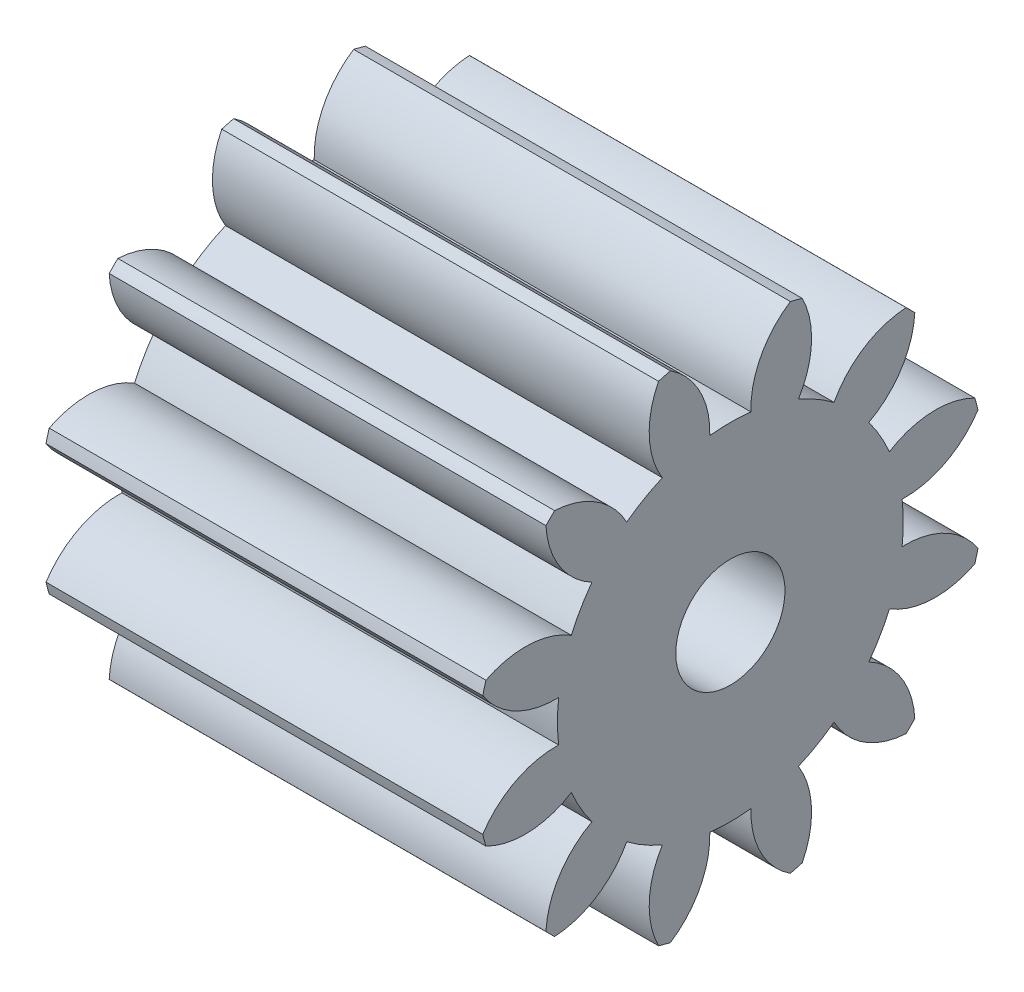
from build123d import *

# Parameters (mm, degrees)
BASPROSKE_W     = 12.7
BASPROSKE_H     = 7.408333333
TOOTHCUT_DEPTH  = 17.463802889
TEETHCUTS_COUNT = 12
TEETHCUTS_ANGLE = 330
BORSKE_R        = 1.5875
BORE_DEPTH      = 50.8000508


with BuildPart() as part:
    # BasProSke → Base-Revolve (revolve)
    with BuildSketch(Plane(origin=(0, 0, 0), x_dir=(1, 0, 0), z_dir=(0, 1, 0)), mode=Mode.PRIVATE) as base_revolve_sk:
        with Locations((6.35, 3.704166667)):
            Rectangle(BASPROSKE_W, BASPROSKE_H)
    revolve(base_revolve_sk.sketch.rotate(Axis((-10, 0, 0), (1, 0, 0)), 180), axis=Axis((-10, 0, 0), (1, 0, 0)))

    # TooCutSke → ToothCut (cut, through all)
    with BuildSketch(Plane(origin=(0, 0, 0), x_dir=(0, 0, -1), z_dir=(1, 0, 0))):
        with BuildLine():
            ThreePointArc((0.598297521, 4.993485027), (0, 5.0292), (-0.598297521, 4.993485027))
            ThreePointArc((-0.598297521, 4.993485027), (-0.89092307, 6.262076537), (-1.773623584, 7.219047766))
            ThreePointArc((-1.773623584, 7.219047766), (0, 7.433733333), (1.773623584, 7.219047766))
            ThreePointArc((1.773623584, 7.219047766), (0.89092307, 6.262076537), (0.598297521, 4.993485027))
        make_face()
    toothcut = extrude(amount=TOOTHCUT_DEPTH, mode=Mode.SUBTRACT)

    # TeethCuts: ToothCut ×12 about axis
    teethcuts_axis = Axis((-10, 0, 0), (1, 0, 0))
    for i in range(1, TEETHCUTS_COUNT):
        add(toothcut.rotate(teethcuts_axis, i * TEETHCUTS_ANGLE / (TEETHCUTS_COUNT - 1)), mode=Mode.SUBTRACT)

    # BorSke → Bore (cut, symmetric)
    with BuildSketch(Plane(origin=(0, 0, 0), x_dir=(0, 0, -1), z_dir=(1, 0, 0))):
        with Locations(Location((0, 0, 0), (0, 0, 180))):
            Circle(BORSKE_R)
    extrude(amount=BORE_DEPTH, both=True, mode=Mode.SUBTRACT)


solid = part.part
